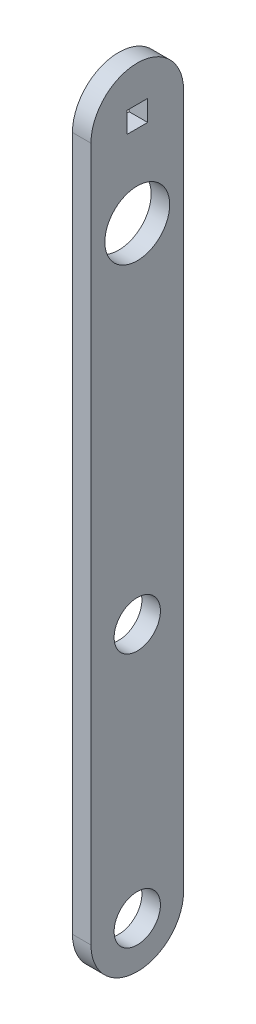
from build123d import *

# Parameters (mm, degrees)
BOSS_EXTRUDE1_DEPTH      = 4
BOSS_EXTRUDE1_DEPTH_BACK = 4
SKETCH2_R                = 14
SKETCH2_R_2              = 10
SKETCH2_W                = 9
SKETCH2_H                = 9


with BuildPart() as part:
    # Sketch2 → Boss-Extrude1 (new, two sides: drawn at the far end of the back side and taken through both)
    with BuildSketch(Plane(origin=(0, 0, 0), x_dir=(0, 0, -1), z_dir=(1, 0, 0)).offset(-BOSS_EXTRUDE1_DEPTH_BACK)):
        with BuildLine():
            Line((-20, 40), (-20, -260))
            ThreePointArc((-20, -260), (0, -280), (20, -260))
            Line((20, -260), (20, 40))
            ThreePointArc((20, 40), (0, 60), (-20, 40))
        make_face()
        Circle(SKETCH2_R, mode=Mode.SUBTRACT)
        with Locations((0, -150)):
            Circle(SKETCH2_R_2, mode=Mode.SUBTRACT)
        with Locations((0, -260)):
            Circle(SKETCH2_R_2, mode=Mode.SUBTRACT)
        with Locations((0, 40)):
            Rectangle(SKETCH2_W, SKETCH2_H, mode=Mode.SUBTRACT)
    extrude(amount=BOSS_EXTRUDE1_DEPTH + BOSS_EXTRUDE1_DEPTH_BACK)


solid = part.part
